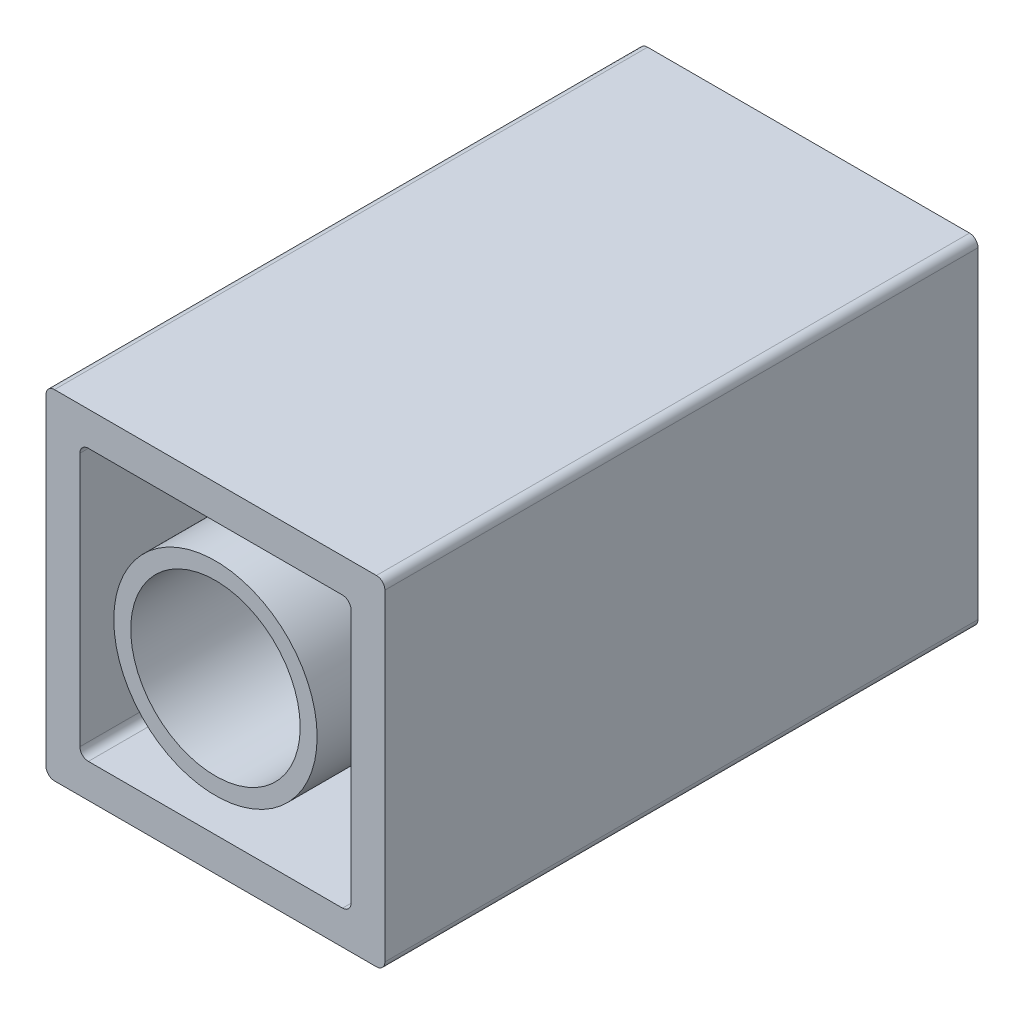
from build123d import *

# Parameters (mm, degrees)
ESQUISSE1_W             = 20
ESQUISSE1_H             = 20
BOSS_EXTRU_1_DEPTH      = 35
COQUE2_T                = -2
CONG_1_R                = 0.5
ESQUISSE2_R             = 6
BOSS_EXTRU_2_DEPTH      = 33
ESQUISSE3_R             = 5
ENL_V_MAT_EXTRU_3_DEPTH = 33
CONG_2_R                = 0.8


with BuildPart() as part:
    # Esquisse1 → Boss.-Extru.1 (new body)
    with BuildSketch(Plane.XY):
        Rectangle(ESQUISSE1_W, ESQUISSE1_H)
    extrude(amount=BOSS_EXTRU_1_DEPTH)

    # Coque2
    coque2_openings = [part.faces().sort_by_distance(p)[0] for p in [
        (0, 0, 35),
    ]]
    offset(amount=COQUE2_T, openings=coque2_openings, kind=Kind.INTERSECTION)

    # Congé1
    cong_1_edges = [part.edges().sort_by_distance(p)[0] for p in [
        (-8, 8, 18.5),
        (-8, -8, 18.5),
        (8, -8, 18.5),
        (8, 8, 18.5),
        (-10, 10, 17.5),
        (10, 10, 17.5),
        (10, -10, 17.5),
        (-10, -10, 17.5),
    ]]
    fillet(cong_1_edges, radius=CONG_1_R)

    # Esquisse2 → Boss.-Extru.2 (add)
    with BuildSketch(Plane.XY.offset(2)):
        with Locations(Location((0, 0, 0), (0, 0, 180))):
            Circle(ESQUISSE2_R)
    extrude(amount=BOSS_EXTRU_2_DEPTH)

    # Esquisse3 → Enlèv. mat.-Extru.3 (cut)
    with BuildSketch(Plane.XY.offset(35)):
        Circle(ESQUISSE3_R)
    extrude(amount=-ENL_V_MAT_EXTRU_3_DEPTH, mode=Mode.SUBTRACT)

    # Congé2
    cong_2_edges = [part.edges().sort_by_distance(p)[0] for p in [
        (6, 0, 2),
    ]]
    fillet(cong_2_edges, radius=CONG_2_R)


solid = part.part
